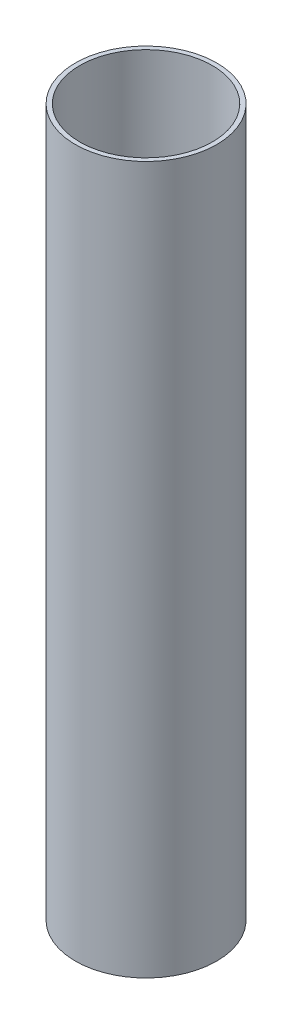
from build123d import *

# Parameters (mm, degrees)
SKETCH1_R           = 20.32
SKETCH1_R_2         = 19.05
EXTRUDE_THIN1_DEPTH = 203.2


with BuildPart() as part:
    # Sketch1 → Extrude-Thin1 (new body)
    with BuildSketch(Plane(origin=(0, 0, 0), x_dir=(1, 0, 0), z_dir=(0, 1, 0))):
        Circle(SKETCH1_R)
        Circle(SKETCH1_R_2, mode=Mode.SUBTRACT)
    extrude(amount=EXTRUDE_THIN1_DEPTH)


solid = part.part
